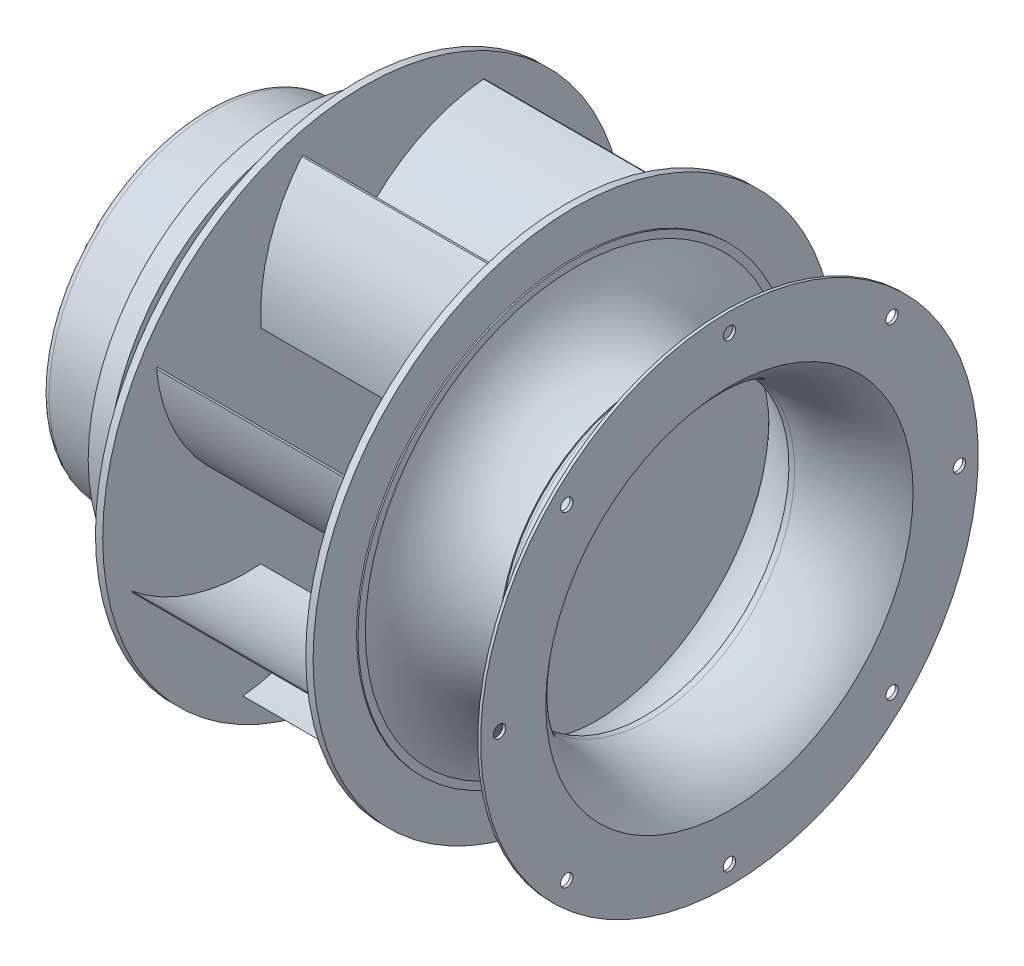
from build123d import *

# Parameters (mm, degrees)
SKETCH2_R          = 180
EXTRUDE1_DEPTH     = 5
SKETCH9_R          = 175
SKETCH9_R_2        = 70
EXTRUDE7_DEPTH     = 3
SKETCH3_R          = 180
EXTRUDE2_DEPTH     = 5
EXTRUDE3_DEPTH     = 145
CIRPATTERN1_COUNT  = 8
SKETCH7_R          = 4.25
EXTRUDE5_DEPTH     = 5
CIRPATTERN2_COUNT  = 8
SKETCH10_R         = 5
CUT_EXTRUDE1_DEPTH = 13.9


with BuildPart() as part:
    # Sketch1 → Revolve1 (revolve)
    with BuildSketch(Plane.XY, mode=Mode.PRIVATE) as revolve1_sk:
        with BuildLine():
            Line((0, 0), (0, 109))
            ThreePointArc((0, 109), (1.464466094, 112.535533906), (5, 114))
            Line((5, 114), (56, 114))
            Line((56, 114), (56, 138))
            Line((56, 138), (69.9, 138))
            Line((69.9, 138), (69.9, 98))
            Line((69.9, 98), (74.9, 98))
            Line((74.9, 98), (74.9, 133))
            Line((74.9, 133), (84.9, 133))
            Line((84.9, 133), (84.9, 98))
            Line((84.9, 98), (103, 98))
            Line((103, 98), (103, 0))
            Line((103, 0), (0, 0))
        make_face()
    revolve(revolve1_sk.sketch.rotate(Axis((0, 0, 0), (1, 0, 0)), 90), axis=Axis((0, 0, 0), (1, 0, 0)))

    # Sketch2 → Extrude1 (add)
    with BuildSketch(Plane(origin=(103, 0, 0), x_dir=(0, 0, -1), z_dir=(1, 0, 0))):
        Circle(SKETCH2_R)
    extrude(amount=EXTRUDE1_DEPTH)

    # Sketch9 → Extrude7 (cut)
    with BuildSketch(Plane.ZY.offset(-103)):
        Circle(SKETCH9_R)
        Circle(SKETCH9_R_2, mode=Mode.SUBTRACT)
    extrude(amount=-EXTRUDE7_DEPTH, mode=Mode.SUBTRACT)



with BuildPart() as body_2:
    # Sketch3 → Extrude2 (new body)
    with BuildSketch(Plane(origin=(248, 0, 0), x_dir=(0, 0, -1), z_dir=(1, 0, 0))):
        Circle(SKETCH3_R)
    extrude(amount=EXTRUDE2_DEPTH)


with BuildPart() as part_1:
    add(part.part)

    add(body_2.part)  # Extrude3 merges body 2
    # Sketch4 → Extrude3 (add)
    with BuildSketch(Plane(origin=(108, 0, 0), x_dir=(0, 0, -1), z_dir=(1, 0, 0))):
        with BuildLine():
            Line((0, 100), (0.866025404, 99.5))
            ThreePointArc((0.866025404, 99.5), (37.979123721, 128.903753251), (83.366025404, 142.394191624))
            Line((83.366025404, 142.394191624), (82.5, 142.894191624))
            ThreePointArc((82.5, 142.894191624), (37.113098317, 129.403753251), (0, 100))
        make_face()
    extrude3 = extrude(amount=EXTRUDE3_DEPTH)

    # CirPattern1: Extrude3 ×8 about axis
    cirpattern1_axis = Axis((0, 0, 0), (1, 0, 0))
    for i in range(1, CIRPATTERN1_COUNT):
        add(extrude3.rotate(cirpattern1_axis, i * 360 / CIRPATTERN1_COUNT))

    # Sketch5 → Revolve2 (revolve)
    with BuildSketch(Plane.XY, mode=Mode.PRIVATE) as revolve2_sk:
        with BuildLine():
            Line((253, 150), (254, 150))
            Line((254, 150), (254, 145))
            ThreePointArc((254, 145), (272.674954292, 116.308769755), (304, 102.5))
            Line((304, 102.5), (304, 101.5))
            ThreePointArc((304, 101.5), (271.858893923, 115.463875634), (253, 145))
            Line((253, 145), (253, 150))
        make_face()
    revolve(revolve2_sk.sketch.rotate(Axis((0, 0, 0), (1, 0, 0)), 90), axis=Axis((0, 0, 0), (1, 0, 0)))

    # Sketch10 → Cut-Extrude1 (cut)
    with BuildSketch(Plane.ZY.offset(-56)):
        with Locations((0, 126)):
            Circle(SKETCH10_R)
        with Locations((126, 0)):
            Circle(SKETCH10_R)
        with Locations((0, -126)):
            Circle(SKETCH10_R)
        with Locations((-126, 0)):
            Circle(SKETCH10_R)
    extrude(amount=-CUT_EXTRUDE1_DEPTH, mode=Mode.SUBTRACT)


with BuildPart() as body_2_2:
    # Sketch6 → Revolve3 (revolve)
    with BuildSketch(Plane.XY, mode=Mode.PRIVATE) as revolve3_sk:
        with BuildLine():
            Line((360, 171.5), (358, 171.5))
            Line((358, 171.5), (358, 126.6))
            ThreePointArc((358, 126.6), (334.481813227, 108.336048031), (305.5, 101.5))
            Line((305.5, 101.5), (301.5, 101.5))
            Line((301.5, 101.5), (301.5, 99.5))
            Line((301.5, 99.5), (305.5, 99.5))
            ThreePointArc((305.5, 99.5), (335.849606698, 106.816473615), (360, 126.6))
            Line((360, 126.6), (360, 171.5))
        make_face()
    revolve(revolve3_sk.sketch.rotate(Axis((0, 0, 0), (1, 0, 0)), 180), axis=Axis((0, 0, 0), (1, 0, 0)))

    # Sketch7 → Extrude5 (cut)
    with BuildSketch(Plane(origin=(360, 0, 0), x_dir=(0, 0, -1), z_dir=(1, 0, 0))):
        with Locations((0, 158.5)):
            Circle(SKETCH7_R)
    extrude5 = extrude(amount=-EXTRUDE5_DEPTH, mode=Mode.SUBTRACT)

    # CirPattern2: Extrude5 ×8 about axis
    cirpattern2_axis = Axis((0, 0, 0), (1, 0, 0))
    for i in range(1, CIRPATTERN2_COUNT):
        add(extrude5.rotate(cirpattern2_axis, i * 360 / CIRPATTERN2_COUNT), mode=Mode.SUBTRACT)


solid = Compound([part_1.part, body_2_2.part])
